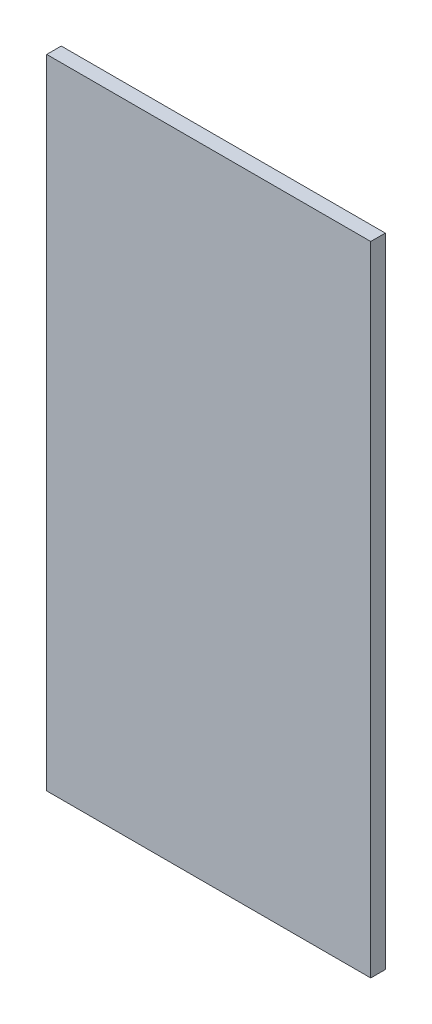
from build123d import *

# Parameters (mm, degrees)
SKETCH_1_W      = 66.829854394
SKETCH_1_H      = 131.549292332
EXTRUDE_1_DEPTH = 3


with BuildPart() as part:
    # 草图1 → 凸台-拉伸1 (new body)
    with BuildSketch(Plane.XY):
        Rectangle(SKETCH_1_W, SKETCH_1_H)
    extrude(amount=EXTRUDE_1_DEPTH)


solid = part.part
